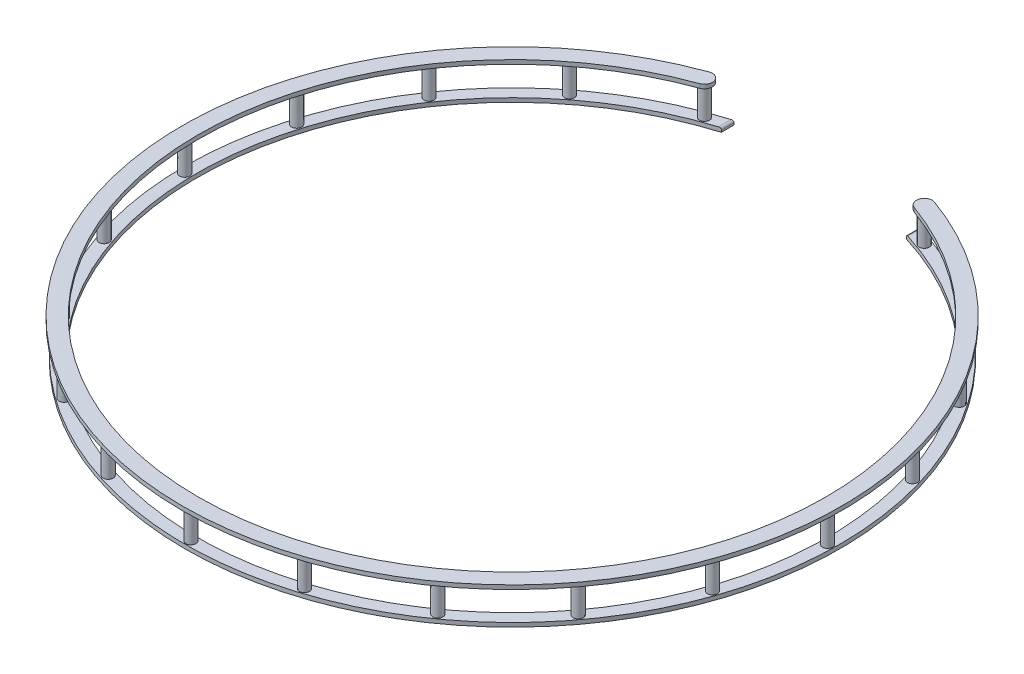
from build123d import *

# Parameters (mm, degrees)
SKETCH1_R                       = 8130.540905
SKETCH1_R_2                     = 7830.540905
BOSS_EXTRUDE1_DEPTH             = 100
CUT_EXTRUDE1_DEPTH              = 100
CUT_EXTRUDE1_DEPTH_BACK         = 100
SKETCH2_W                       = 3700
SKETCH2_H                       = 2006.573318274
SKETCH4_R                       = 125
BOSS_EXTRUDE2_DEPTH             = 750
CIRPATTERN1_COUNT               = 10
CIRPATTERN1_ANGLE               = 160
CIRPATTERN1_THE_OTHER_WAY_COUNT = 10
CIRPATTERN1_THE_OTHER_WAY_ANGLE = 160
BOSS_EXTRUDE3_DEPTH             = 100
CUT_EXTRUDE2_DEPTH              = 2000
CUT_EXTRUDE2_DEPTH_BACK         = 2000
SKETCH6_W                       = 4592.787799638
SKETCH6_H                       = 733.127628032
FILLET1_R                       = 50
FILLET2_R                       = 50


with BuildPart() as part:
    # Sketch1 → Boss-Extrude1 (new body)
    with BuildSketch(Plane(origin=(0, 0, 0), x_dir=(1, 0, 0), z_dir=(0, 1, 0))):
        Circle(SKETCH1_R)
        Circle(SKETCH1_R_2, mode=Mode.SUBTRACT)
    extrude(amount=BOSS_EXTRUDE1_DEPTH)

    # Sketch2 → Cut-Extrude1 (cut, two sides: drawn at the far end of the back side and taken through both)
    with BuildSketch(Plane(origin=(0, 100, 0), x_dir=(1, 0, 0), z_dir=(0, 1, 0)).offset(-CUT_EXTRUDE1_DEPTH_BACK)):
        with Locations((0, 7830.540905)):
            Rectangle(SKETCH2_W, SKETCH2_H)
    extrude(amount=CUT_EXTRUDE1_DEPTH + CUT_EXTRUDE1_DEPTH_BACK, mode=Mode.SUBTRACT)

    # Sketch4 → Boss-Extrude2 (add)
    with BuildSketch(Plane(origin=(0, 100, 0), x_dir=(1, 0, 0), z_dir=(0, 1, 0))):
        with Locations((0, -7980.540905)):
            Circle(SKETCH4_R)
    boss_extrude2 = extrude(amount=BOSS_EXTRUDE2_DEPTH)

    # CirPattern1: Boss-Extrude2 ×10 about axis
    cirpattern1_axis = Axis((0, 100, 0), (0, 1, 0))
    for i in range(1, CIRPATTERN1_COUNT):
        add(boss_extrude2.rotate(cirpattern1_axis, i * CIRPATTERN1_ANGLE / (CIRPATTERN1_COUNT - 1)))

    # CirPattern1 the other way: Boss-Extrude2 ×10 about axis
    cirpattern1_the_other_way_axis = Axis((0, 100, 0), (0, -1, 0))
    for i in range(1, CIRPATTERN1_THE_OTHER_WAY_COUNT):
        add(boss_extrude2.rotate(cirpattern1_the_other_way_axis, i * CIRPATTERN1_THE_OTHER_WAY_ANGLE / (CIRPATTERN1_THE_OTHER_WAY_COUNT - 1)))

    # Sketch5 → Boss-Extrude3 (add)
    with BuildSketch(Plane(origin=(0, 850, 0), x_dir=(1, 0, 0), z_dir=(0, 1, 0))):
        with BuildLine():
            ThreePointArc((-2796.404660275, 7683.240254702), (0, -8190.682788488), (2796.404660275, 7683.240254702))
            ThreePointArc((2796.404660275, 7683.240254702), (2545.520887751, 7566.15431444), (2662.606828013, 7315.270541915))
            ThreePointArc((2662.606828013, 7315.270541915), (0, -7799.142791237), (-2662.606828013, 7315.270541915))
            ThreePointArc((-2662.606828013, 7315.270541915), (-2545.520887751, 7566.15431444), (-2796.404660275, 7683.240254702))
        make_face()
    extrude(amount=BOSS_EXTRUDE3_DEPTH)

    # Sketch6 → Cut-Extrude2 (cut, two sides: drawn at the far end of the back side and taken through both)
    with BuildSketch(Plane(origin=(0, 100, 0), x_dir=(1, 0, 0), z_dir=(0, 1, 0)).offset(-CUT_EXTRUDE2_DEPTH_BACK)):
        with Locations((0, 7770.8120983)):
            Rectangle(SKETCH6_W, SKETCH6_H)
    extrude(amount=CUT_EXTRUDE2_DEPTH + CUT_EXTRUDE2_DEPTH_BACK, mode=Mode.SUBTRACT)

    # Fillet1
    fillet1_edges = [part.edges().sort_by_distance(p)[0] for p in [
        (-2296.393899819, 100, -7642.877479678),
    ]]
    fillet(fillet1_edges, radius=FILLET1_R)

    # Fillet2
    fillet2_edges = [part.edges().sort_by_distance(p)[0] for p in [
        (2296.393899819, 100, -7642.877479678),
    ]]
    fillet(fillet2_edges, radius=FILLET2_R)


solid = part.part
